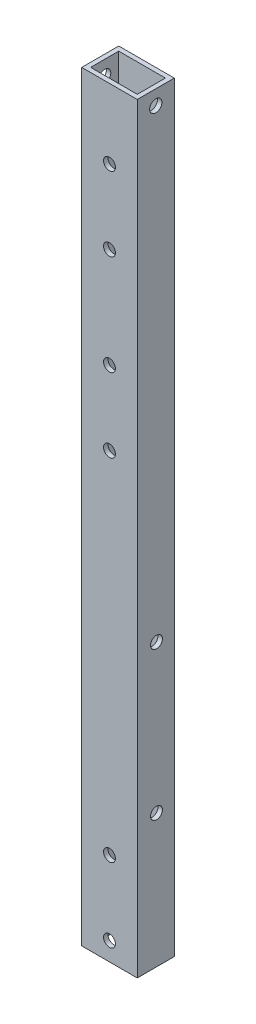
from build123d import *

# Parameters (mm, degrees)
SKETCH_1_W          = 15
SKETCH_1_H          = 10
SKETCH_1_W_2        = 12.6
SKETCH_1_H_2        = 7.6
EXTRUDE_1_DEPTH     = 110
SKETCH_2_R          = 1.6
CUT_EXTRUDE_1_DEPTH = 100
SKETCH_3_R          = 1.6
CUT_EXTRUDE_2_DEPTH = 15
SKETCH_5_W          = 15
SKETCH_5_H          = 10
CUT_EXTRUDE_4_DEPTH = 14.5
SKETCH_6_R          = 1.6
CUT_EXTRUDE_5_DEPTH = 15
CUT_EXTRUDE_6_DEPTH = 15
SKETCH_8_R          = 1.6
CUT_EXTRUDE_7_DEPTH = 10


with BuildPart() as part:
    # ｽｹｯﾁ1 → ﾎﾞｽ - 押し出し1 (new, symmetric)
    with BuildSketch(Plane(origin=(0, 0, 0), x_dir=(1, 0, 0), z_dir=(0, 1, 0))):
        Rectangle(SKETCH_1_W, SKETCH_1_H)
        Rectangle(SKETCH_1_W_2, SKETCH_1_H_2, mode=Mode.SUBTRACT)
    extrude(amount=EXTRUDE_1_DEPTH, both=True)

    # ｽｹｯﾁ2 → ｶｯﾄ - 押し出し1 (cut)
    with BuildSketch(Plane(origin=(0, 0, -5), x_dir=(-1, 0, 0), z_dir=(0, 0, -1))):
        with Locations((0, -85)):
            Circle(SKETCH_2_R)
        with Locations((0, -105)):
            Circle(SKETCH_2_R)
    extrude(amount=-CUT_EXTRUDE_1_DEPTH, mode=Mode.SUBTRACT)

    # ｽｹｯﾁ3 → ｶｯﾄ - 押し出し2 (cut)
    with BuildSketch(Plane.ZY.offset(7.5)):
        with Locations((-0.2, -74)):
            Circle(SKETCH_3_R)
        with Locations((-0.2, -34)):
            Circle(SKETCH_3_R)
    extrude(amount=-CUT_EXTRUDE_2_DEPTH, mode=Mode.SUBTRACT)

    # ｽｹｯﾁ5 → ｶｯﾄ - 押し出し4 (cut)
    with BuildSketch(Plane(origin=(0, 110, 0), x_dir=(1, 0, 0), z_dir=(0, 1, 0))):
        Rectangle(SKETCH_5_W, SKETCH_5_H)
    extrude(amount=-CUT_EXTRUDE_4_DEPTH, mode=Mode.SUBTRACT)

    # ｽｹｯﾁ6 → ｶｯﾄ - 押し出し5 (cut)
    with BuildSketch(Plane(origin=(0, 0, -5), x_dir=(-1, 0, 0), z_dir=(0, 0, -1))):
        with Locations((0, 56.66)):
            Circle(SKETCH_6_R)
        with Locations((0, 76.66)):
            Circle(SKETCH_6_R)
    extrude(amount=-CUT_EXTRUDE_5_DEPTH, mode=Mode.SUBTRACT)

    # ｽｹｯﾁ7 → ｶｯﾄ - 押し出し6 (cut)
    with BuildSketch(Plane.ZY.offset(7.5)):
        with BuildLine():
            ThreePointArc((0, 93.15), (-1.65, 91.5), (0, 89.85))
            ThreePointArc((0, 89.85), (1.65, 91.5), (0, 93.15))
        make_face()
    extrude(amount=-CUT_EXTRUDE_6_DEPTH, mode=Mode.SUBTRACT)

    # ｽｹｯﾁ8 → ｶｯﾄ - 押し出し7 (cut)
    with BuildSketch(Plane(origin=(0, 0, -5), x_dir=(-1, 0, 0), z_dir=(0, 0, -1))):
        with Locations((0, 9.6)):
            Circle(SKETCH_8_R)
        with Locations((0, 29.6)):
            Circle(SKETCH_8_R)
    extrude(amount=-CUT_EXTRUDE_7_DEPTH, mode=Mode.SUBTRACT)


solid = part.part
